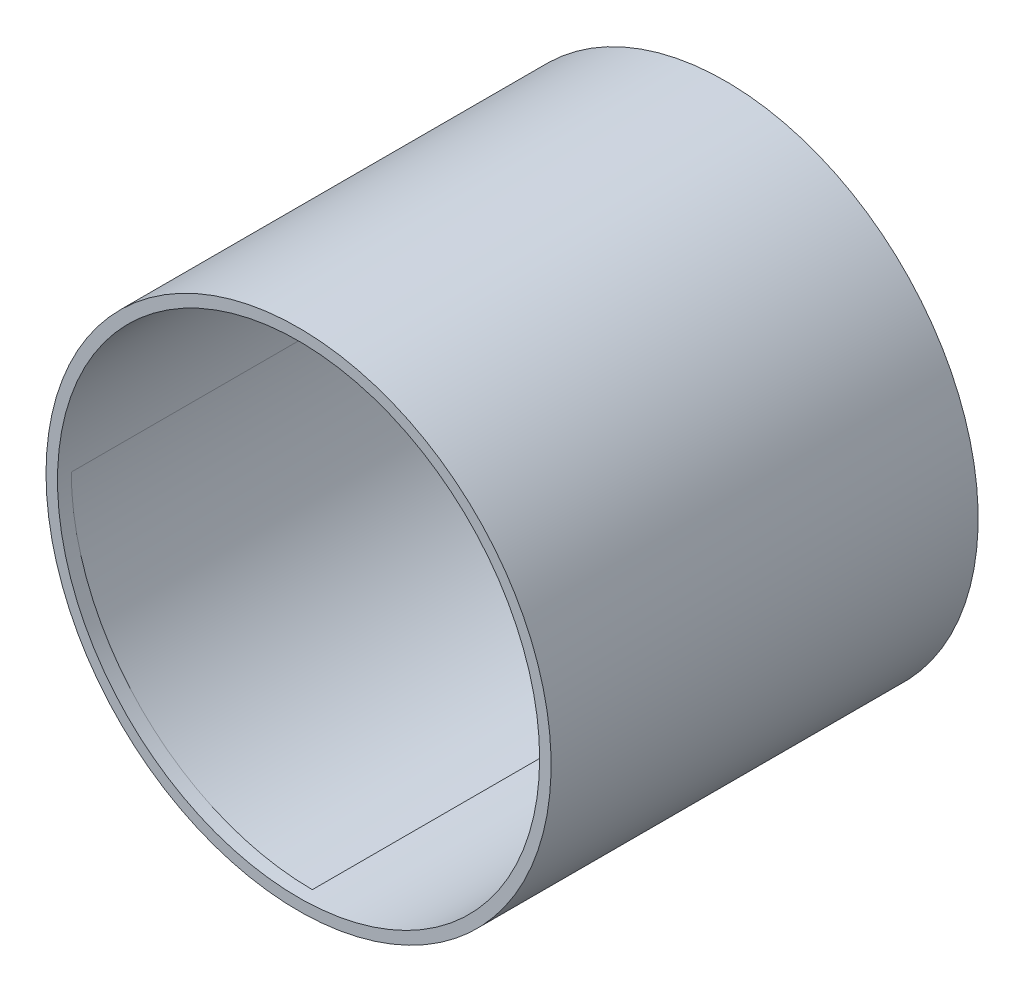
from build123d import *

# Parameters (mm, degrees)
SKICA1_R                 = 55
P_IDAT_VYSUNUT_M1_DEPTH  = 93
SKICA3_R                 = 52.5
ODEBRAT_VYSUNUT_M1_DEPTH = 90
SKICA5_R                 = 2.5
ODEBRAT_VYSUNUT_M5_DEPTH = 90


with BuildPart() as part:
    # Skica1 → Přidat vysunutím1 (new body)
    with BuildSketch(Plane.XY):
        with Locations(Location((0, 0, 0), (0, 0, 180))):
            Circle(SKICA1_R)
    extrude(amount=P_IDAT_VYSUNUT_M1_DEPTH)

    # Skica3 → Odebrat vysunutím1 (cut)
    with BuildSketch(Plane.XY.offset(93)):
        Circle(SKICA3_R)
    extrude(amount=-ODEBRAT_VYSUNUT_M1_DEPTH, mode=Mode.SUBTRACT)

    # Skica5 → Odebrat vysunutím5 (cut)
    with BuildSketch(Plane(origin=(0, 0, 0), x_dir=(-1, 0, 0), z_dir=(0, 0, -1))):
        Circle(SKICA5_R)
        with BuildLine():
            Line((0, -4.754963748), (0, -52.754963748))
            ThreePointArc((0, -52.754963748), (37.280920542, -37.291104979), (52.72020336, 0))
            Line((52.72020336, 0), (4.72020336, 0))
            Line((4.72020336, 0), (0, -4.754963748))
        make_face()
    extrude(amount=-ODEBRAT_VYSUNUT_M5_DEPTH, mode=Mode.SUBTRACT)


solid = part.part
